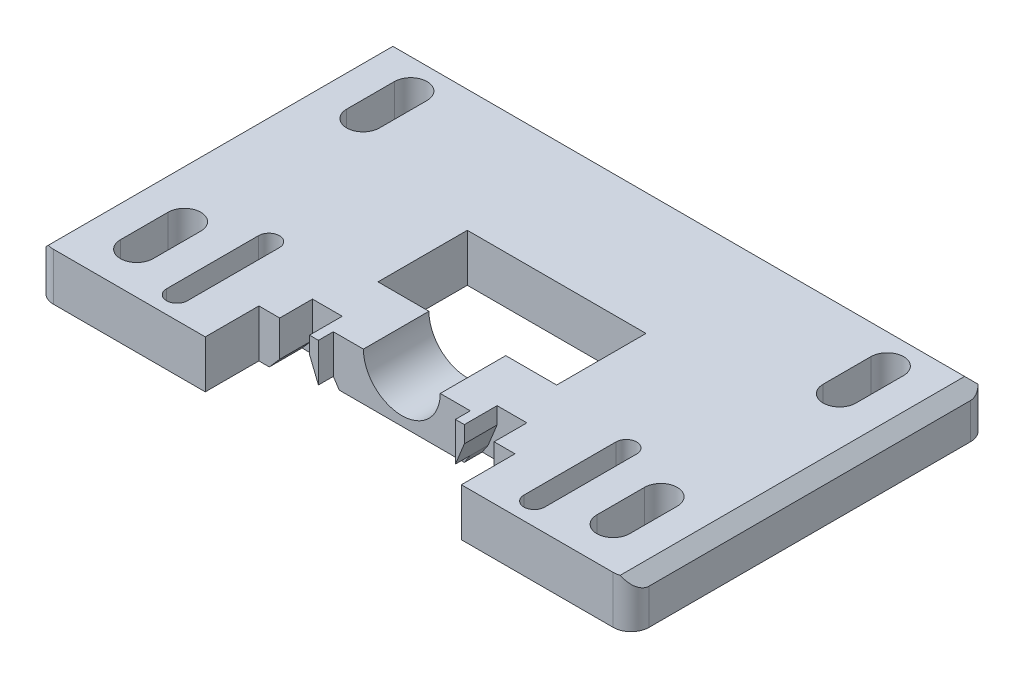
from build123d import *

# Parameters (mm, degrees)
SKETCH1_W           = 30
SKETCH1_H           = 15
BOSS_EXTRUDE1_DEPTH = 8
SKETCH4_R           = 6.45
CUT_EXTRUDE1_DEPTH  = 11
CUT_EXTRUDE2_DEPTH  = 5.5
CHAMFER1_SIZE       = 2
FILLET1_R           = 3


with BuildPart() as part:
    # Sketch1 → Boss-Extrude1 (new body)
    with BuildSketch(Plane(origin=(0, 0, 0), x_dir=(1, 0, 0), z_dir=(0, 1, 0))):
        Polygon((50, 30), (-50, 30), (-50, -30), (-21.5, -30), (-21.5, -21), (-18, -21), (-18, -15.5), (-13, -15.5), (-13, -21), (-11.5, -21), (-11.5, -18.5), (11.5, -18.5), (11.5, -21), (13, -21), (13, -15.5), (18, -15.5), (18, -21), (21.5, -21), (21.5, -30), (50, -30), align=None)
        with BuildLine():
            ThreePointArc((-42.75, -15), (-40, -12.25), (-37.25, -15))
            Line((-37.25, -15), (-37.25, -19))
            Line((-37.25, -19), (-37.25, -23))
            ThreePointArc((-37.25, -23), (-40, -25.75), (-42.75, -23))
            Line((-42.75, -23), (-42.75, -19))
            Line((-42.75, -19), (-42.75, -15))
        make_face(mode=Mode.SUBTRACT)
        with BuildLine():
            ThreePointArc((-28.25, -26.25), (-30, -28), (-31.75, -26.25))
            Line((-31.75, -26.25), (-31.75, -10.81))
            ThreePointArc((-31.75, -10.81), (-30, -9.06), (-28.25, -10.81))
            Line((-28.25, -10.81), (-28.25, -26.25))
        make_face(mode=Mode.SUBTRACT)
        with BuildLine():
            ThreePointArc((28.25, -10.81), (30, -9.06), (31.75, -10.81))
            Line((31.75, -10.81), (31.75, -26.25))
            ThreePointArc((31.75, -26.25), (30, -28), (28.25, -26.25))
            Line((28.25, -26.25), (28.25, -10.81))
        make_face(mode=Mode.SUBTRACT)
        with BuildLine():
            ThreePointArc((42.75, -23), (40, -25.75), (37.25, -23))
            Line((37.25, -23), (37.25, -19))
            Line((37.25, -19), (37.25, -15))
            ThreePointArc((37.25, -15), (40, -12.25), (42.75, -15))
            Line((42.75, -15), (42.75, -19))
            Line((42.75, -19), (42.75, -23))
        make_face(mode=Mode.SUBTRACT)
        with BuildLine():
            ThreePointArc((-42.75, 23), (-40, 25.75), (-37.25, 23))
            Line((-37.25, 23), (-37.25, 19))
            Line((-37.25, 19), (-37.25, 15))
            ThreePointArc((-37.25, 15), (-40, 12.25), (-42.75, 15))
            Line((-42.75, 15), (-42.75, 19))
            Line((-42.75, 19), (-42.75, 23))
        make_face(mode=Mode.SUBTRACT)
        Rectangle(SKETCH1_W, SKETCH1_H, mode=Mode.SUBTRACT)
        with BuildLine():
            ThreePointArc((37.25, 23), (40, 25.75), (42.75, 23))
            Line((42.75, 23), (42.75, 19))
            Line((42.75, 19), (42.75, 15))
            ThreePointArc((42.75, 15), (40, 12.25), (37.25, 15))
            Line((37.25, 15), (37.25, 19))
            Line((37.25, 19), (37.25, 23))
        make_face(mode=Mode.SUBTRACT)
    extrude(amount=BOSS_EXTRUDE1_DEPTH)

    # Sketch4 → Cut-Extrude1 (cut)
    with BuildSketch(Plane.XY.offset(18.5)):
        with Locations((0, 8)):
            Circle(SKETCH4_R)
    extrude(amount=-CUT_EXTRUDE1_DEPTH, mode=Mode.SUBTRACT)

    # Sketch5 → Cut-Extrude2 (cut)
    with BuildSketch(Plane.XY.offset(21)):
        Polygon((13, 0), (13, 5.2), (11.5, 1.5), (11.5, 0), align=None)
        Polygon((19.75, 0), (18, 2), (18, 0), align=None)
        Polygon((-11.5, 0), (-11.5, 1.5), (-13, 5.2), (-13, 0), align=None)
        Polygon((-18, 2), (-19.75, 0), (-18, 0), align=None)
        Polygon((11.5, 0), (11.5, 1.5), (10.5, 0), align=None)
        Polygon((-11.5, 0), (-10.5, 0), (-11.5, 1.5), align=None)
    extrude(amount=-CUT_EXTRUDE2_DEPTH, mode=Mode.SUBTRACT)

    # Chamfer1
    chamfer1_edges = [part.edges().sort_by_distance(p)[0] for p in [
        (50, 8, 0),
        (0, 8, -30),
        (-50, 8, 0),
    ]]
    chamfer(chamfer1_edges, length=CHAMFER1_SIZE)

    # Fillet1
    fillet1_edges = [part.edges().sort_by_distance(p)[0] for p in [
        (-50, 3, 30),
        (50, 3, 30),
        (50, 3, -30),
        (-50, 3, -30),
    ]]
    fillet(fillet1_edges, radius=FILLET1_R)


solid = part.part
